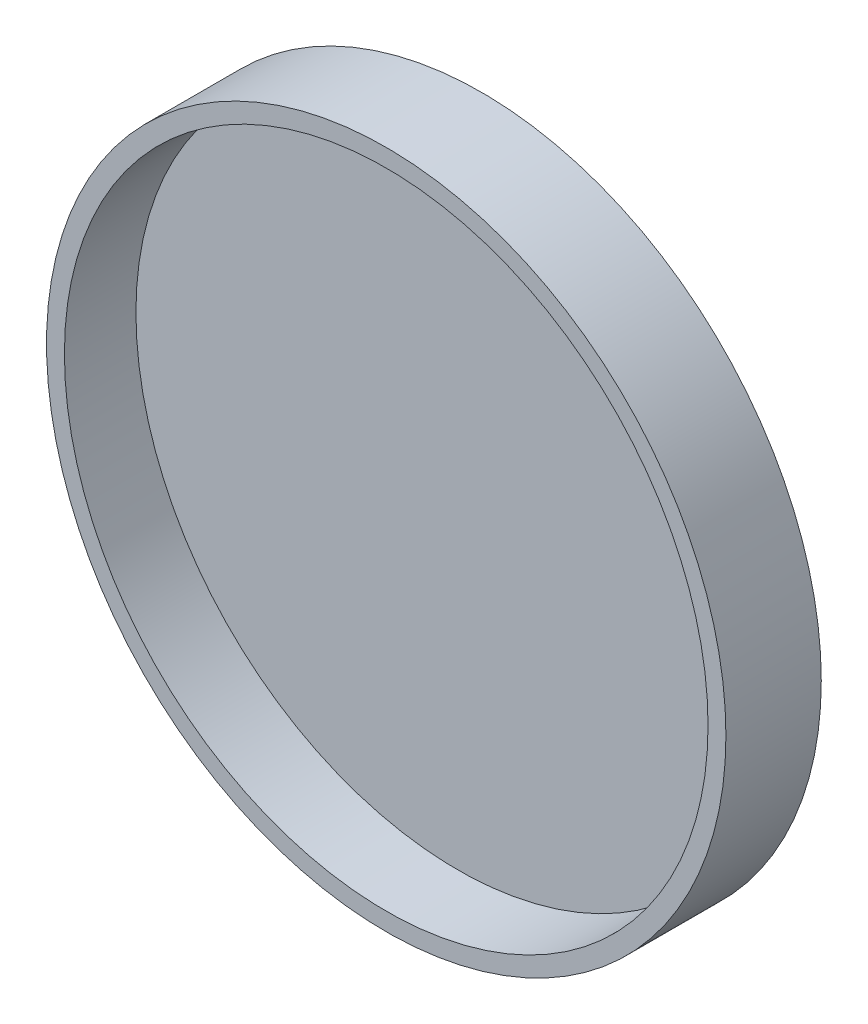
from build123d import *

# Parameters (mm, degrees)
SKETCH_1_R      = 6.5
EXTRUDE_1_DEPTH = 0.5
SKETCH_2_R      = 7.75
EXTRUDE_2_DEPTH = 2.5
SKETCH_3_R      = 9
EXTRUDE_3_DEPTH = 2
SKETCH_4_R      = 14.25
EXTRUDE_4_DEPTH = 1
SKETCH_5_R      = 14.25
SKETCH_5_R_2    = 13.5
EXTRUDE_5_DEPTH = 3


with BuildPart() as part:
    # Эскиз1 → Бобышка-Вытянуть1 (new body)
    with BuildSketch(Plane.XY):
        Circle(SKETCH_1_R)
    extrude(amount=EXTRUDE_1_DEPTH)

    # Эскиз2 → Бобышка-Вытянуть2 (add)
    with BuildSketch(Plane.XY.offset(0.5)):
        Circle(SKETCH_2_R)
    extrude(amount=EXTRUDE_2_DEPTH)

    # Эскиз3 → Бобышка-Вытянуть3 (add)
    with BuildSketch(Plane.XY.offset(3)):
        Circle(SKETCH_3_R)
    extrude(amount=EXTRUDE_3_DEPTH)

    # Эскиз4 → Бобышка-Вытянуть4 (add)
    with BuildSketch(Plane.XY.offset(5)):
        Circle(SKETCH_4_R)
    extrude(amount=EXTRUDE_4_DEPTH)

    # Эскиз5 → Бобышка-Вытянуть5 (add)
    with BuildSketch(Plane.XY.offset(6)):
        Circle(SKETCH_5_R)
        Circle(SKETCH_5_R_2, mode=Mode.SUBTRACT)
    extrude(amount=EXTRUDE_5_DEPTH)


solid = part.part
